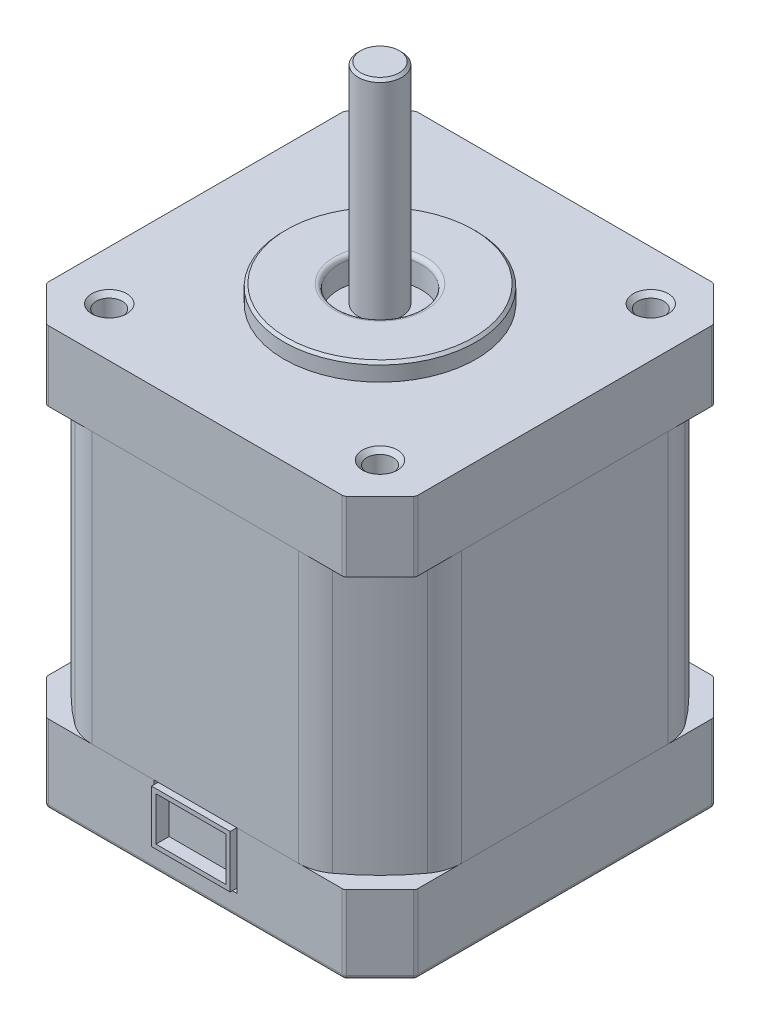
from build123d import *

# Parameters (mm, degrees)
EXTRUDE_1_DEPTH     = 9
EXTRUDE_START       = 48
EXTRUDE_2_DEPTH     = 8
EXTRUDE_3_DEPTH     = 31
SKETCH_3_R          = 4.75
CUT_EXTRUDE_1_DEPTH = 3
SKETCH_4_R          = 4.75
SKETCH_4_R_2        = 2.5
CUT_EXTRUDE_2_DEPTH = 0.5
SKETCH_5_R          = 0.5
CUT_EXTRUDE_3_DEPTH = 0.5
CHAMFER_1_SIZE      = 0.3
FILLET_1_R          = 0.5
FILLET_2_R          = 0.5
SKETCH_6_R          = 11
SKETCH_6_R_2        = 4.75
EXTRUDE_4_DEPTH     = 2
CUT_EXTRUDE_START   = -1
SKETCH_7_R          = 4.75
CUT_EXTRUDE_4_DEPTH = 1
CHAMFER_2_SIZE      = 0.3
FILLET_3_R          = 0.5
SKETCH_8_R          = 2.5
EXTRUDE_5_DEPTH     = 24
CHAMFER_4_SIZE      = 0.3
SKETCH_10_W         = 9.5
SKETCH_10_H         = 6.5
CUT_EXTRUDE_6_DEPTH = 1
SKETCH_11_W         = 9
SKETCH_11_H         = 6
SKETCH_11_W_2       = 8
SKETCH_11_H_2       = 5
EXTRUDE_6_DEPTH     = 1.5
SKETCH_16_R         = 1.5
CUT_EXTRUDE_9_DEPTH = 7
CHAMFER_35_SIZE     = 0.5


with BuildPart() as part:
    # Эскиз1 → Бобышка-Вытянуть1 (new body)
    with BuildSketch(Plane(origin=(0, 0, 0), x_dir=(1, 0, 0), z_dir=(0, 1, 0))):
        Polygon((-17.033766184, 21.15), (-21.15, 17.033766184), (-21.15, -17.033766184), (-17.033766184, -21.15), (17.033766184, -21.15), (21.15, -17.033766184), (21.15, 17.033766184), (17.033766184, 21.15), align=None)
    extrude(amount=EXTRUDE_1_DEPTH)

    # Эскиз3 → Вырез-Вытянуть1 (cut)
    with BuildSketch(Plane.XZ):
        Circle(SKETCH_3_R)
    extrude(amount=-CUT_EXTRUDE_1_DEPTH, mode=Mode.SUBTRACT)

    # Эскиз4 → Вырез-Вытянуть2 (cut)
    with BuildSketch(Plane.XZ.offset(-3)):
        Circle(SKETCH_4_R)
        Circle(SKETCH_4_R_2, mode=Mode.SUBTRACT)
    extrude(amount=-CUT_EXTRUDE_2_DEPTH, mode=Mode.SUBTRACT)

    # Эскиз5 → Вырез-Вытянуть3 (cut)
    with BuildSketch(Plane.XZ.offset(-3)):
        Circle(SKETCH_5_R)
    extrude(amount=-CUT_EXTRUDE_3_DEPTH, mode=Mode.SUBTRACT)

    # Фаска1
    chamfer_1_edges = [part.edges().sort_by_distance(p)[0] for p in [
        (-2.5, 3, 0),
    ]]
    chamfer(chamfer_1_edges, length=CHAMFER_1_SIZE)

    # Скругление1
    fillet_1_edges = [part.edges().sort_by_distance(p)[0] for p in [
        (0, 0, 21.15),
        (19.091883092, 0, 19.091883092),
        (21.15, 0, 0),
        (19.091883092, 0, -19.091883092),
        (0, 0, -21.15),
        (-19.091883092, 0, -19.091883092),
        (-21.15, 0, 0),
        (-19.091883092, 0, 19.091883092),
        (-4.75, 0, 0),
        (21.15, 4.5, 17.033766184),
        (17.033766184, 4.5, 21.15),
        (-17.033766184, 4.5, 21.15),
        (-21.15, 4.5, 17.033766184),
        (-21.15, 4.5, -17.033766184),
        (-17.033766184, 4.5, -21.15),
        (17.033766184, 4.5, -21.15),
        (21.15, 4.5, -17.033766184),
    ]]
    fillet(fillet_1_edges, radius=FILLET_1_R)

    # Эскиз10 → Вырез-Вытянуть6 (cut)
    with BuildSketch(Plane.XY.offset(21.15)):
        with Locations((0, 5.75)):
            Rectangle(SKETCH_10_W, SKETCH_10_H)
    extrude(amount=-CUT_EXTRUDE_6_DEPTH, mode=Mode.SUBTRACT)


with BuildPart() as body_2:
    # Эскиз1<3> → Бобышка-Вытянуть2 (new body)
    with BuildSketch(Plane(origin=(0, 0, 0), x_dir=(1, 0, 0), z_dir=(0, 1, 0)).offset(EXTRUDE_START)):
        Polygon((-17.033766184, 21.15), (-21.15, 17.033766184), (-21.15, -17.033766184), (-17.033766184, -21.15), (17.033766184, -21.15), (21.15, -17.033766184), (21.15, 17.033766184), (17.033766184, 21.15), align=None)
    extrude(amount=-EXTRUDE_2_DEPTH)

    # Скругление2
    fillet_2_edges = [body_2.edges().sort_by_distance(p)[0] for p in [
        (21.15, 44, 17.033766184),
        (17.033766184, 44, 21.15),
        (-17.033766184, 44, 21.15),
        (-21.15, 44, 17.033766184),
        (-21.15, 44, -17.033766184),
        (-17.033766184, 44, -21.15),
        (17.033766184, 44, -21.15),
        (21.15, 44, -17.033766184),
    ]]
    fillet(fillet_2_edges, radius=FILLET_2_R)

    # Эскиз6 → Бобышка-Вытянуть4 (add)
    with BuildSketch(Plane(origin=(0, 48, 0), x_dir=(1, 0, 0), z_dir=(0, 1, 0))):
        Circle(SKETCH_6_R)
        Circle(SKETCH_6_R_2, mode=Mode.SUBTRACT)
    extrude(amount=EXTRUDE_4_DEPTH)

    # Эскиз7 → Вырез-Вытянуть4 (cut)
    with BuildSketch(Plane(origin=(0, 48, 0), x_dir=(1, 0, 0), z_dir=(0, 1, 0)).offset(CUT_EXTRUDE_START)):
        Circle(SKETCH_7_R)
    extrude(amount=CUT_EXTRUDE_4_DEPTH, mode=Mode.SUBTRACT)

    # Фаска2
    chamfer_2_edges = [body_2.edges().sort_by_distance(p)[0] for p in [
        (-11, 50, 0),
    ]]
    chamfer(chamfer_2_edges, length=CHAMFER_2_SIZE)

    # Скругление3
    fillet_3_edges = [body_2.edges().sort_by_distance(p)[0] for p in [
        (-4.75, 50, 0),
    ]]
    fillet(fillet_3_edges, radius=FILLET_3_R)

    # Эскиз16 → Вырез-Вытянуть9 (cut)
    with BuildSketch(Plane(origin=(0, 48, 0), x_dir=(1, 0, 0), z_dir=(0, 1, 0))):
        with Locations((-15.5, 15.5)):
            Circle(SKETCH_16_R)
        with Locations((15.5, 15.5)):
            Circle(SKETCH_16_R)
        with Locations((15.5, -15.5)):
            Circle(SKETCH_16_R)
        with Locations((-15.5, -15.5)):
            Circle(SKETCH_16_R)
    extrude(amount=-CUT_EXTRUDE_9_DEPTH, mode=Mode.SUBTRACT)

    # Фаска35
    chamfer_35_edges = [body_2.edges().sort_by_distance(p)[0] for p in [
        (-17, 48, 15.5),
        (14, 48, 15.5),
        (14, 48, -15.5),
        (-17, 48, -15.5),
    ]]
    chamfer(chamfer_35_edges, length=CHAMFER_35_SIZE)


with BuildPart() as body_3:
    # Эскиз2 → Бобышка-Вытянуть3 (new body)
    with BuildSketch(Plane(origin=(0, 9, 0), x_dir=(1, 0, 0), z_dir=(0, 1, 0))):
        with BuildLine():
            Line((-11.797351398, -21.15), (11.797351398, -21.15))
            ThreePointArc((11.797351398, -21.15), (13.348560603, -20.903288335), (14.746689247, -20.1875))
            ThreePointArc((14.746689247, -20.1875), (17.67766953, -17.67766953), (20.1875, -14.746689247))
            ThreePointArc((20.1875, -14.746689247), (20.903288335, -13.348560603), (21.15, -11.797351398))
            Line((21.15, -11.797351398), (21.15, 11.797351398))
            ThreePointArc((21.15, 11.797351398), (20.903288335, 13.348560603), (20.1875, 14.746689247))
            ThreePointArc((20.1875, 14.746689247), (17.67766953, 17.67766953), (14.746689247, 20.1875))
            ThreePointArc((14.746689247, 20.1875), (13.348560603, 20.903288335), (11.797351398, 21.15))
            Line((11.797351398, 21.15), (-11.797351398, 21.15))
            ThreePointArc((-11.797351398, 21.15), (-13.348560603, 20.903288335), (-14.746689247, 20.1875))
            ThreePointArc((-14.746689247, 20.1875), (-17.67766953, 17.67766953), (-20.1875, 14.746689247))
            ThreePointArc((-20.1875, 14.746689247), (-20.903288335, 13.348560603), (-21.15, 11.797351398))
            Line((-21.15, 11.797351398), (-21.15, -11.797351398))
            ThreePointArc((-21.15, -11.797351398), (-20.903288335, -13.348560603), (-20.1875, -14.746689247))
            ThreePointArc((-20.1875, -14.746689247), (-17.67766953, -17.67766953), (-14.746689247, -20.1875))
            ThreePointArc((-14.746689247, -20.1875), (-13.348560603, -20.903288335), (-11.797351398, -21.15))
        make_face()
    extrude(amount=EXTRUDE_3_DEPTH)


with BuildPart() as body_4:
    # Эскиз8 → Бобышка-Вытянуть5 (new body)
    with BuildSketch(Plane(origin=(0, 48, 0), x_dir=(1, 0, 0), z_dir=(0, 1, 0))):
        Circle(SKETCH_8_R)
    extrude(amount=EXTRUDE_5_DEPTH)

    # Фаска4
    chamfer_4_edges = [body_4.edges().sort_by_distance(p)[0] for p in [
        (-2.5, 72, 0),
    ]]
    chamfer(chamfer_4_edges, length=CHAMFER_4_SIZE)


with BuildPart() as body_5:
    # Эскиз11 → Бобышка-Вытянуть6 (new body)
    with BuildSketch(Plane.XY.offset(20.15)):
        with Locations((0, 5.75)):
            Rectangle(SKETCH_11_W, SKETCH_11_H)
        with Locations((0, 5.75)):
            Rectangle(SKETCH_11_W_2, SKETCH_11_H_2, mode=Mode.SUBTRACT)
    extrude(amount=EXTRUDE_6_DEPTH)


solid = Compound([part.part, body_2.part, body_3.part, body_4.part, body_5.part])
